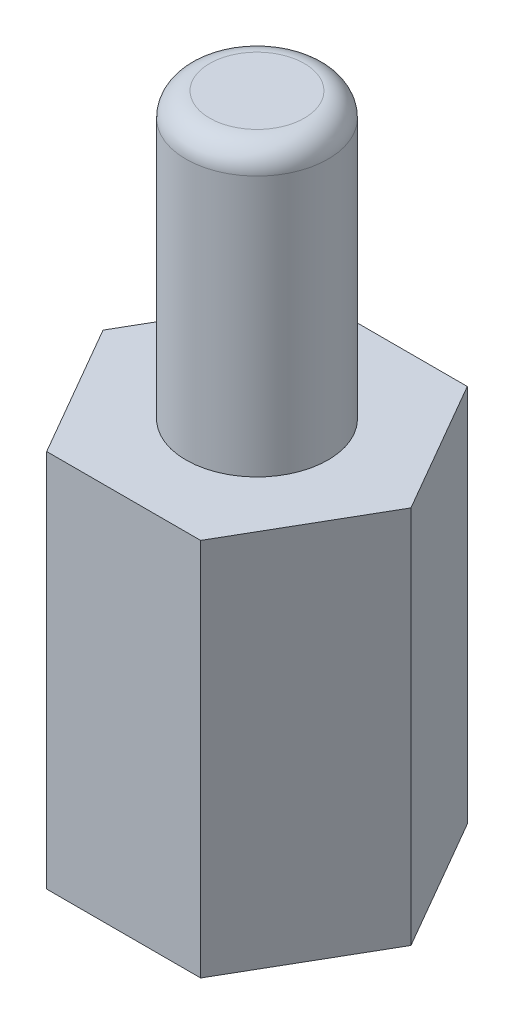
from build123d import *

# Parameters (mm, degrees)
SKETCH_1_R          = 1.5
EXTRUDE_1_DEPTH     = 14
FILLET_1_R          = 0.5
SKETCH_2_R          = 1.5
EXTRUDE_2_DEPTH     = 8
SKETCH_1_2_R        = 1.5
CUT_EXTRUDE_1_DEPTH = 7


with BuildPart() as part:
    # 草图1 → 凸台-拉伸1 (new body)
    with BuildSketch(Plane(origin=(0, 0, 0), x_dir=(1, 0, 0), z_dir=(0, 1, 0))):
        with Locations(Location((0, 0, 0), (0, 0, 270))):
            Circle(SKETCH_1_R)
    extrude(amount=EXTRUDE_1_DEPTH)

    # 圆角1
    fillet_1_edges = [part.edges().sort_by_distance(p)[0] for p in [
        (0, 14, -1.5),
    ]]
    fillet(fillet_1_edges, radius=FILLET_1_R)

    # 草图2 → 凸台-拉伸2 (add)
    with BuildSketch(Plane(origin=(0, 0, 0), x_dir=(1, 0, 0), z_dir=(0, 1, 0))):
        Polygon((-1.625, 2.814582562), (-3.25, 0), (-1.625, -2.814582562), (1.625, -2.814582562), (3.25, 0), (1.625, 2.814582562), align=None)
        with Locations(Location((0, 0, 0), (0, 0, 270))):
            Circle(SKETCH_2_R, mode=Mode.SUBTRACT)
    extrude(amount=EXTRUDE_2_DEPTH)

    # 草图1<2> → 切除-拉伸1 (cut)
    with BuildSketch(Plane(origin=(0, 0, 0), x_dir=(1, 0, 0), z_dir=(0, 1, 0))):
        with Locations(Location((0, 0, 0), (0, 0, 270))):
            Circle(SKETCH_1_2_R)
    extrude(amount=CUT_EXTRUDE_1_DEPTH, mode=Mode.SUBTRACT)


solid = part.part
